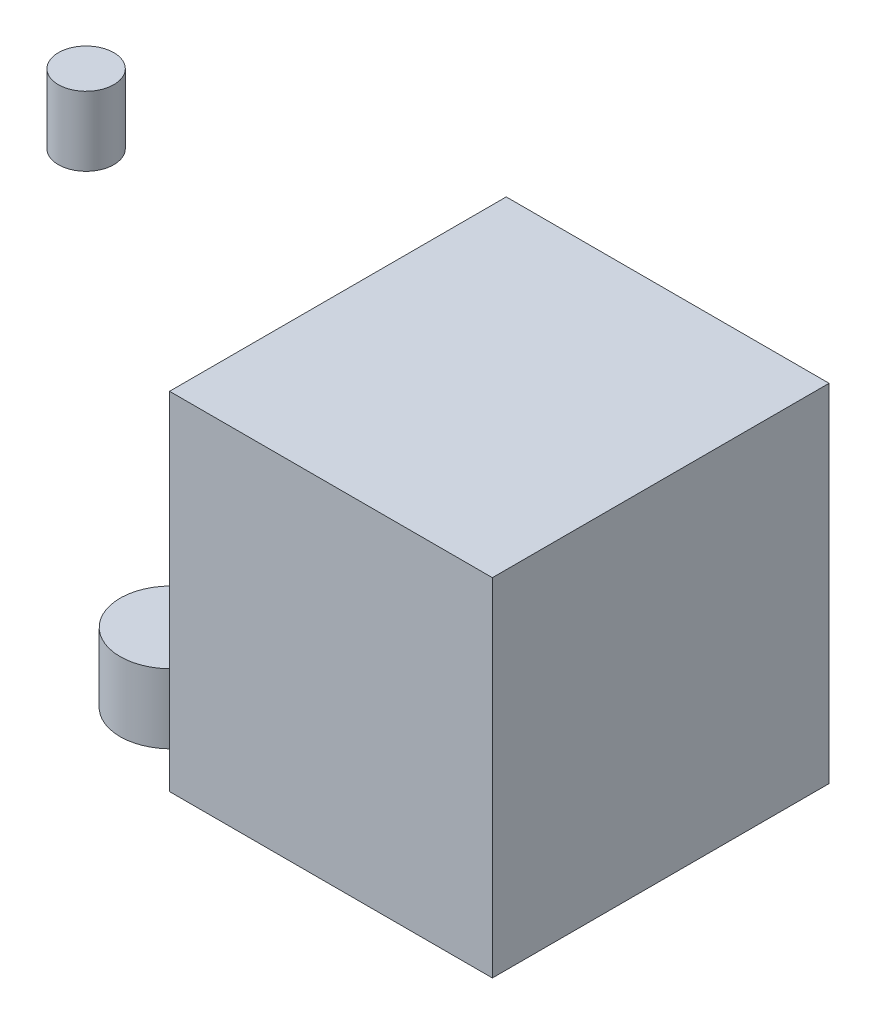
from build123d import *

# Parameters (mm, degrees)
SKETCH_1_W      = 46.55787774
SKETCH_1_H      = 48.556217662
EXTRUDE_1_DEPTH = 50
SKETCH_2_R      = 7.308846902
EXTRUDE_2_DEPTH = 10
SKETCH_3_R      = 4
EXTRUDE_3_DEPTH = 10


with BuildPart() as part:
    # 草图1 → 凸台-拉伸1 (new body)
    with BuildSketch(Plane(origin=(0, 0, 0), x_dir=(1, 0, 0), z_dir=(0, 1, 0))):
        Rectangle(SKETCH_1_W, SKETCH_1_H)
    extrude(amount=EXTRUDE_1_DEPTH)


with BuildPart() as body_2:
    # 草图2 → 凸台-拉伸2 (new body)
    with BuildSketch(Plane(origin=(0, 0, 0), x_dir=(1, 0, 0), z_dir=(0, 1, 0))):
        with Locations(Location((-33.699554643, -13.673728025, 0), (0, 0, 270))):
            Circle(SKETCH_2_R)
    extrude(amount=EXTRUDE_2_DEPTH)


with BuildPart() as body_3:
    # 草图3 → 凸台-拉伸3 (new body)
    with BuildSketch(Plane(origin=(0, 50, 0), x_dir=(1, 0, 0), z_dir=(0, 1, 0))):
        with Locations(Location((-59.590874547, 0, 0), (0, 0, 270))):
            Circle(SKETCH_3_R)
    extrude(amount=EXTRUDE_3_DEPTH)


solid = Compound([part.part, body_2.part, body_3.part])
